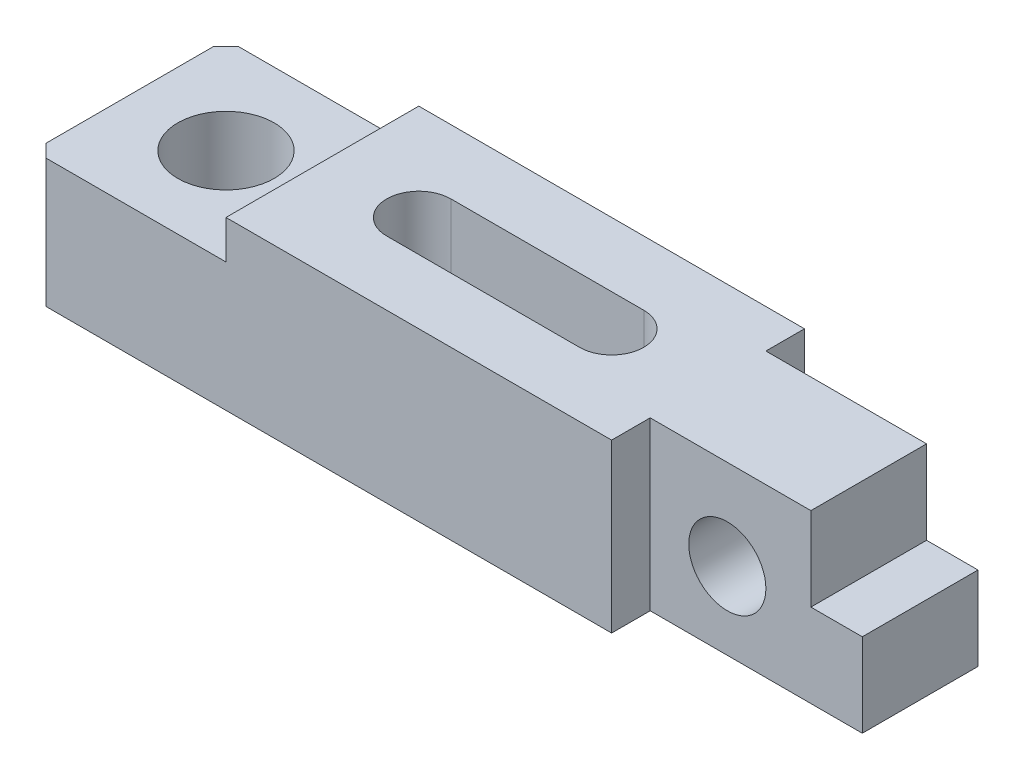
from build123d import *

# Parameters (mm, degrees)
ESTRUSIONE_ESTRUSIONE1_DEPTH = 15
SCHIZZO3_W                   = 33
SCHIZZO3_H                   = 6
TAGLIO_ESTRUSIONE1_DEPTH     = 127.609636284
TAGLIO_ESTRUSIONE2_DEPTH     = 127.609636284
FORO_15_0_15_2_D             = 15
FORO_12_0_12_1_D             = 12
SMUSSO1_SIZE                 = 2


with BuildPart() as part:
    # Schizzo2 → Estrusione-Estrusione1 (new, symmetric)
    with BuildSketch(Plane.XY):
        Polygon((0, 0), (123, 0), (123, 13), (115, 13), (115, 26), (30, 26), (30, 20), (0, 20), align=None)
    extrude(amount=ESTRUSIONE_ESTRUSIONE1_DEPTH, both=True)

    # Schizzo3 → Taglio-Estrusione1 (cut, through all)
    with BuildSketch(Plane(origin=(0, 26, 0), x_dir=(1, 0, 0), z_dir=(0, 1, 0))):
        with Locations((106.5, -12)):
            Rectangle(SCHIZZO3_W, SCHIZZO3_H)
        with Locations((106.5, 12)):
            Rectangle(SCHIZZO3_W, SCHIZZO3_H)
    extrude(amount=-TAGLIO_ESTRUSIONE1_DEPTH, mode=Mode.SUBTRACT)

    # Schizzo4 → Taglio-Estrusione2 (cut, through all)
    with BuildSketch(Plane(origin=(0, 26, 0), x_dir=(1, 0, 0), z_dir=(0, 1, 0))):
        with BuildLine():
            Line((45, 5), (75, 5))
            ThreePointArc((75, 5), (80, 0), (75, -5))
            Line((75, -5), (45, -5))
            ThreePointArc((45, -5), (40, 0), (45, 5))
        make_face()
    extrude(amount=-TAGLIO_ESTRUSIONE2_DEPTH, mode=Mode.SUBTRACT)

    # Foro Ø15.0 (15)-2 (through all)
    with Locations(Plane(origin=(0, 20, 0), x_dir=(1, 0, 0), z_dir=(0, 1, 0))):
        with Locations((15, 0)):
            Hole(FORO_15_0_15_2_D / 2)

    # Foro Ø12.0 (12)-1 (through all)
    with Locations(Plane.XY.offset(9)):
        with Locations((102, 12)):
            Hole(FORO_12_0_12_1_D / 2)

    # Smusso1
    smusso1_edges = [part.edges().sort_by_distance(p)[0] for p in [
        (0, 10, -15),
        (0, 10, 15),
    ]]
    chamfer(smusso1_edges, length=SMUSSO1_SIZE)


solid = part.part
